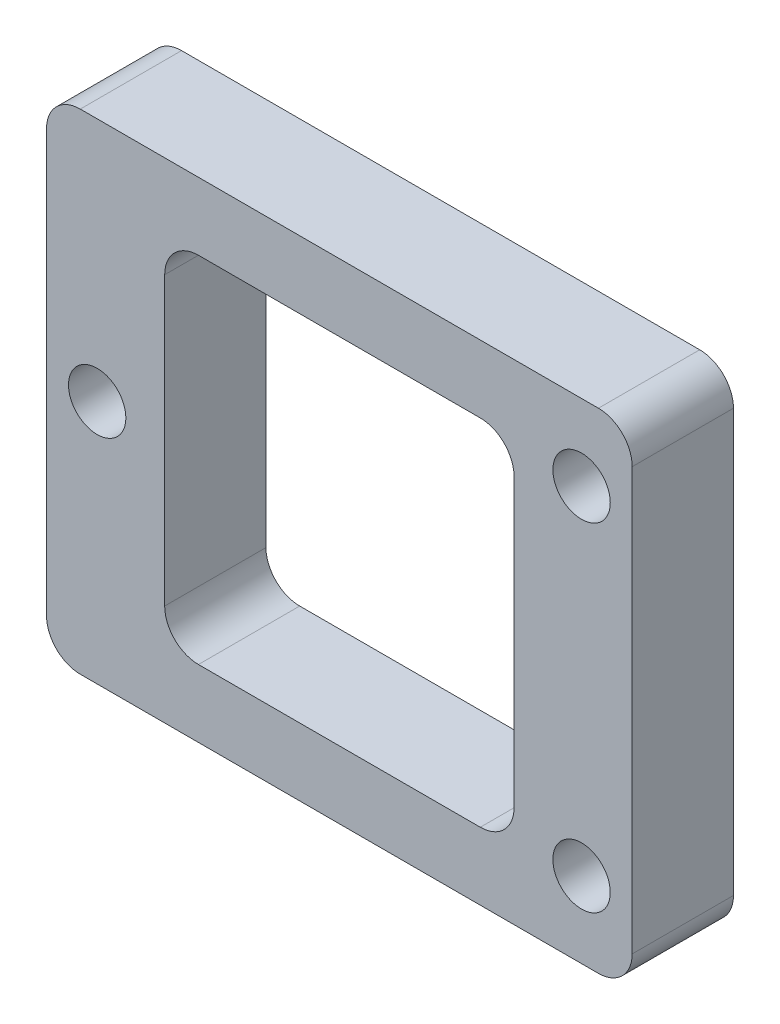
from build123d import *

# Parameters (mm, degrees)
SKETCH_1_W          = 34.7
SKETCH_1_H          = 29
EXTRUDE_1_DEPTH     = 6
SKETCH_2_R          = 1.7
CUT_EXTRUDE_1_DEPTH = 25
SKETCH_3_W          = 20.7
SKETCH_3_H          = 21
CUT_EXTRUDE_2_DEPTH = 10
FILLET_1_R          = 2
FILLET_2_R          = 2


with BuildPart() as part:
    # 草图1 → 凸台-拉伸1 (new body)
    with BuildSketch(Plane.XY):
        Rectangle(SKETCH_1_W, SKETCH_1_H)
    extrude(amount=EXTRUDE_1_DEPTH)

    # 草图2 → 切除-拉伸1 (cut)
    with BuildSketch(Plane.XY.offset(6)):
        with Locations((14.35, -10)):
            Circle(SKETCH_2_R)
        with Locations((-14.35, 0)):
            Circle(SKETCH_2_R)
        with Locations((14.35, 10)):
            Circle(SKETCH_2_R)
    extrude(amount=-CUT_EXTRUDE_1_DEPTH, mode=Mode.SUBTRACT)

    # 草图3 → 切除-拉伸2 (cut)
    with BuildSketch(Plane.XY.offset(6)):
        Rectangle(SKETCH_3_W, SKETCH_3_H)
    extrude(amount=-CUT_EXTRUDE_2_DEPTH, mode=Mode.SUBTRACT)

    # 圆角1
    fillet_1_edges = [part.edges().sort_by_distance(p)[0] for p in [
        (10.35, 10.5, 3),
        (10.35, -10.5, 3),
        (-10.35, -10.5, 3),
        (-10.35, 10.5, 3),
    ]]
    fillet(fillet_1_edges, radius=FILLET_1_R)

    # 圆角2
    fillet_2_edges = [part.edges().sort_by_distance(p)[0] for p in [
        (17.35, -14.5, 3),
        (-17.35, -14.5, 3),
        (-17.35, 14.5, 3),
        (17.35, 14.5, 3),
    ]]
    fillet(fillet_2_edges, radius=FILLET_2_R)


solid = part.part
